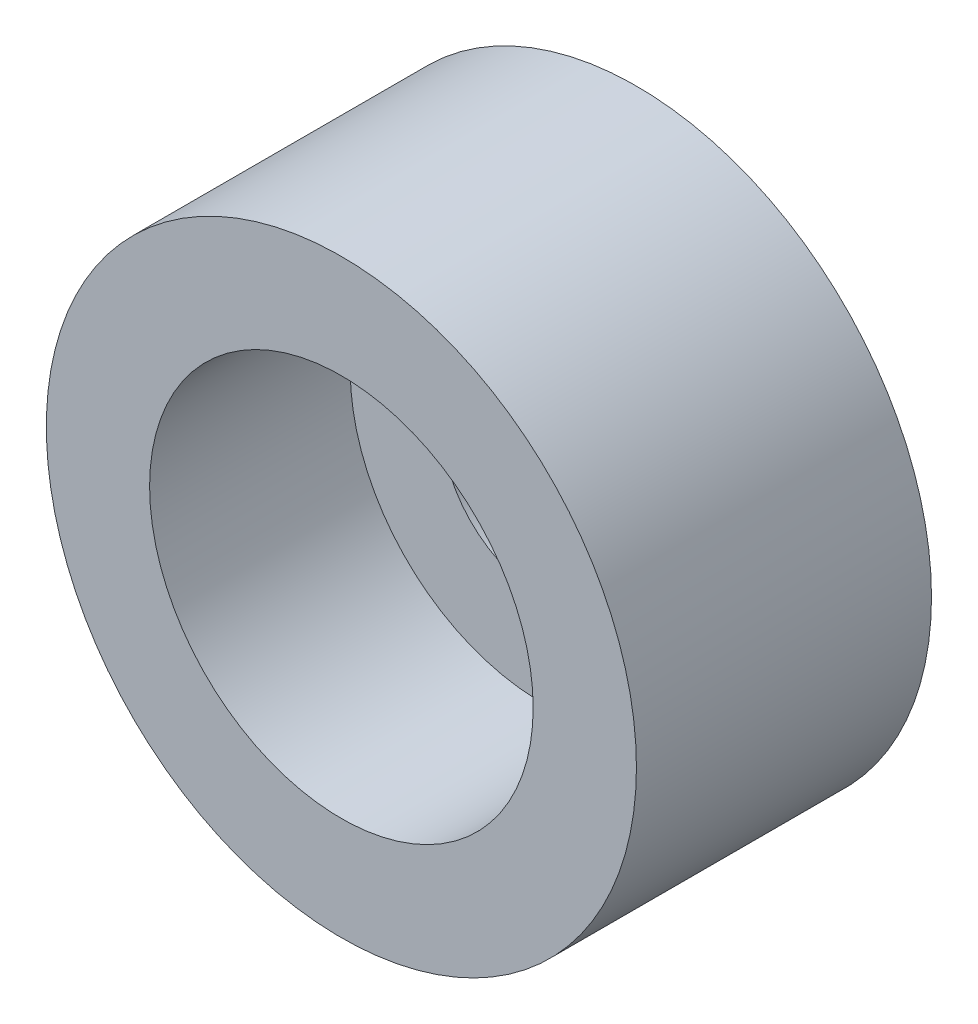
from build123d import *

# Parameters (mm, degrees)
SKETCH1_R                                       = 5
BOSS_EXTRUDE1_DEPTH                             = 5
CBORE_FOR_M3_SOCKET_HEAD_CAP_SCREW1_D           = 3.4
CBORE_FOR_M3_SOCKET_HEAD_CAP_SCREW1_CBORE_D     = 6.5
CBORE_FOR_M3_SOCKET_HEAD_CAP_SCREW1_CBORE_DEPTH = 3.4


with BuildPart() as part:
    # Sketch1 → Boss-Extrude1 (new body)
    with BuildSketch(Plane.XY):
        Circle(SKETCH1_R)
    extrude(amount=BOSS_EXTRUDE1_DEPTH)

    # CBORE for M3 Socket Head Cap Screw1 (through all)
    with Locations(Plane.XY.offset(5)):
        with Locations((0, 0)):
            CounterBoreHole(CBORE_FOR_M3_SOCKET_HEAD_CAP_SCREW1_D / 2, CBORE_FOR_M3_SOCKET_HEAD_CAP_SCREW1_CBORE_D / 2, CBORE_FOR_M3_SOCKET_HEAD_CAP_SCREW1_CBORE_DEPTH)


solid = part.part
